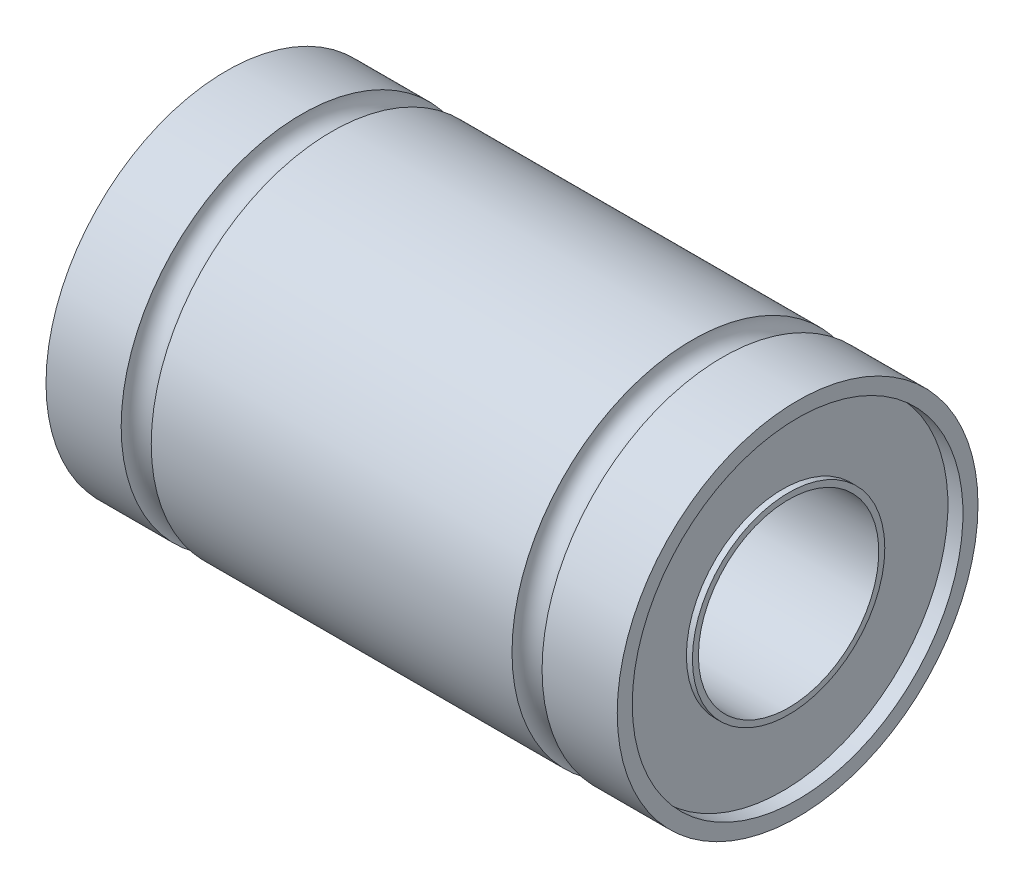
from build123d import *


with BuildPart() as part:
    # Sketch1 → Revolve3 (revolve)
    with BuildSketch(Plane.XY, mode=Mode.PRIVATE) as revolve3_sk:
        with BuildLine():
            Line((3.5, 6), (15.5, 6))
            ThreePointArc((15.5, 6), (16, 5.5), (16.5, 6))
            Line((16.5, 6), (19, 6))
            Line((19, 6), (19, 5.5))
            Line((19, 5.5), (18.5, 5.5))
            Line((18.5, 5.5), (18.5, 3.2))
            Line((18.5, 3.2), (18.7, 3.2))
            Line((18.7, 3.2), (18.7, 3))
            Line((18.7, 3), (0.3, 3))
            Line((0.3, 3), (0.3, 3.2))
            Line((0.3, 3.2), (0.5, 3.2))
            Line((0.5, 3.2), (0.5, 5.5))
            Line((0.5, 5.5), (0, 5.5))
            Line((0, 5.5), (0, 6))
            Line((0, 6), (2.5, 6))
            ThreePointArc((2.5, 6), (3, 5.5), (3.5, 6))
        make_face()
    revolve(revolve3_sk.sketch.rotate(Axis((-0.95, 0, 0), (1, 0, 0)), 90), axis=Axis((-0.95, 0, 0), (1, 0, 0)))


solid = part.part
